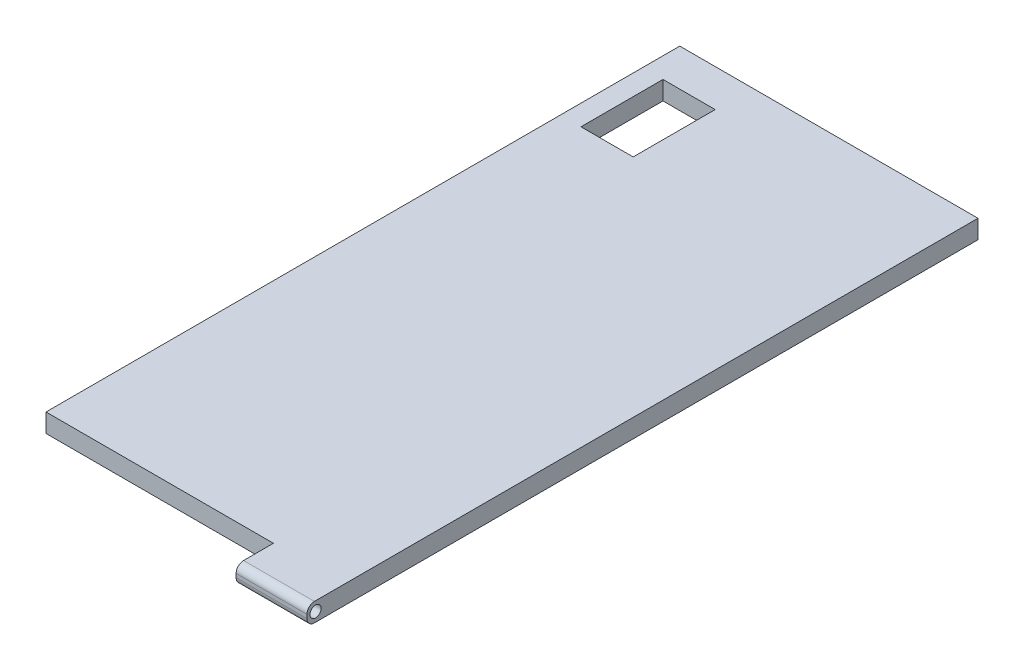
from build123d import *

# Parameters (mm, degrees)
SKETCH4_W           = 40
SKETCH4_H           = 85
BOSS_EXTRUDE1_DEPTH = 2.5
SKETCH5_W           = 9.5
SKETCH5_H           = 5
BOSS_EXTRUDE2_DEPTH = 2.5
SKETCH12_W          = 7
SKETCH12_H          = 11
CUT_EXTRUDE1_DEPTH  = 5
FILLET4_R           = 1
FILLET5_R           = 1
SKETCH13_R          = 0.75
CUT_EXTRUDE2_DEPTH  = 10


with BuildPart() as part:
    # Sketch4 → Boss-Extrude1 (new body)
    with BuildSketch(Plane(origin=(0, 0, 0), x_dir=(1, 0, 0), z_dir=(0, 1, 0))):
        Rectangle(SKETCH4_W, SKETCH4_H)
    extrude(amount=BOSS_EXTRUDE1_DEPTH)

    # Sketch5 → Boss-Extrude2 (add)
    with BuildSketch(Plane(origin=(0, 2.5, 0), x_dir=(1, 0, 0), z_dir=(0, 1, 0))):
        with Locations((15.25, -45)):
            Rectangle(SKETCH5_W, SKETCH5_H)
    extrude(amount=-BOSS_EXTRUDE2_DEPTH)

    # Sketch12 → Cut-Extrude1 (cut)
    with BuildSketch(Plane(origin=(0, 2.5, 0), x_dir=(1, 0, 0), z_dir=(0, 1, 0))):
        with Locations((-13.75, 32)):
            Rectangle(SKETCH12_W, SKETCH12_H)
    extrude(amount=-CUT_EXTRUDE1_DEPTH, mode=Mode.SUBTRACT)

    # Fillet4
    fillet4_edges = [part.edges().sort_by_distance(p)[0] for p in [
        (15.25, 2.5, 47.5),
    ]]
    fillet(fillet4_edges, radius=FILLET4_R)

    # Fillet5
    fillet5_edges = [part.edges().sort_by_distance(p)[0] for p in [
        (15.25, 0, 47.5),
    ]]
    fillet(fillet5_edges, radius=FILLET5_R)

    # Sketch13 → Cut-Extrude2 (cut)
    with BuildSketch(Plane.ZY.offset(-10.5)):
        with Locations((46.35, 1.25)):
            Circle(SKETCH13_R)
    extrude(amount=-CUT_EXTRUDE2_DEPTH, mode=Mode.SUBTRACT)


solid = part.part
